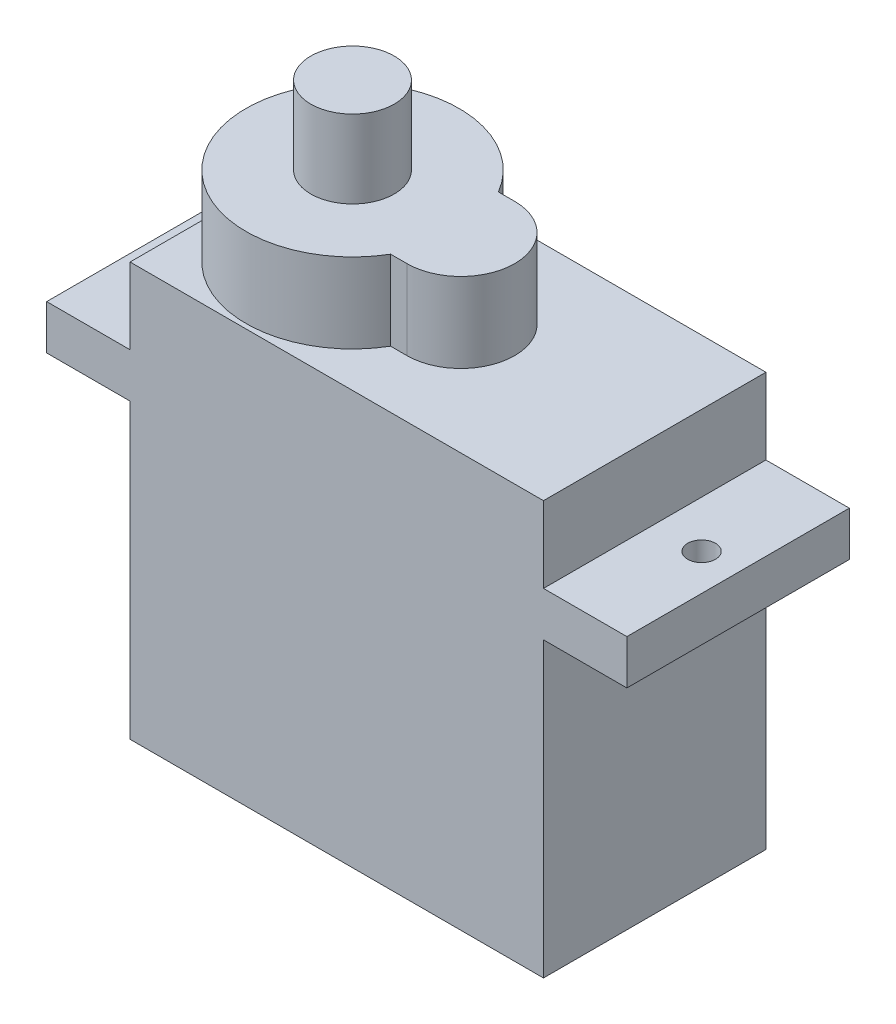
from build123d import *

# Parameters (mm, degrees)
SKETCH1_W           = 22.3
SKETCH1_H           = 12
BOSS_EXTRUDE1_DEPTH = 22.3
SKETCH2_W           = 12
SKETCH2_H           = 2.4
BOSS_EXTRUDE2_DEPTH = 4.5
EXTRUDE_1_DEPTH     = 4.3
SKETCH_1_R          = 0.75
CUT_EXTRUDE_1_DEPTH = 10
SKETCH_2_R          = 2.25
EXTRUDE_2_DEPTH     = 4.2


with BuildPart() as part:
    # Sketch1 → Boss-Extrude1 (new body)
    with BuildSketch(Plane(origin=(0, 0, 0), x_dir=(1, 0, 0), z_dir=(0, 1, 0))):
        Rectangle(SKETCH1_W, SKETCH1_H)
    extrude(amount=BOSS_EXTRUDE1_DEPTH)

    # Sketch2 → Boss-Extrude2 (add)
    with BuildSketch(Plane.ZY.offset(11.15)):
        with Locations((0, 17)):
            Rectangle(SKETCH2_W, SKETCH2_H)
    boss_extrude2 = extrude(amount=BOSS_EXTRUDE2_DEPTH)

    # 镜向1: Boss-Extrude2 across plane
    add(boss_extrude2.mirror(Plane(origin=(0, 0, 0), x_dir=(0, 0, 1), z_dir=(1, 0, 0))))

    # Sketch5 → 凸台-拉伸1 (add)
    with BuildSketch(Plane(origin=(0, 22.3, 0), x_dir=(1, 0, 0), z_dir=(0, 1, 0))):
        with BuildLine():
            Line((0.693260261, 2.906739739), (-0.188814246, 2.906739739))
            ThreePointArc((-0.188814246, 2.906739739), (-10.9, 0), (-0.188814246, -2.906739739))
            Line((-0.188814246, -2.906739739), (0.693260261, -2.906739739))
            ThreePointArc((0.693260261, -2.906739739), (3.6, 0), (0.693260261, 2.906739739))
        make_face()
    extrude(amount=EXTRUDE_1_DEPTH)

    # 草图1 → 切除-拉伸1 (cut)
    with BuildSketch(Plane(origin=(0, 18.2, 0), x_dir=(1, 0, 0), z_dir=(0, 1, 0))):
        with Locations(Location((-13.68, 0, 0), (0, 0, 270))):
            Circle(SKETCH_1_R)
        with Locations(Location((13.68, 0, 0), (0, 0, 270))):
            Circle(SKETCH_1_R)
    extrude(amount=-CUT_EXTRUDE_1_DEPTH, mode=Mode.SUBTRACT)

    # 草图2 → 凸台-拉伸2 (add)
    with BuildSketch(Plane(origin=(0, 26.6, 0), x_dir=(1, 0, 0), z_dir=(0, 1, 0))):
        with Locations(Location((-5.15, 0, 0), (0, 0, 270))):
            Circle(SKETCH_2_R)
    extrude(amount=EXTRUDE_2_DEPTH)


solid = part.part
